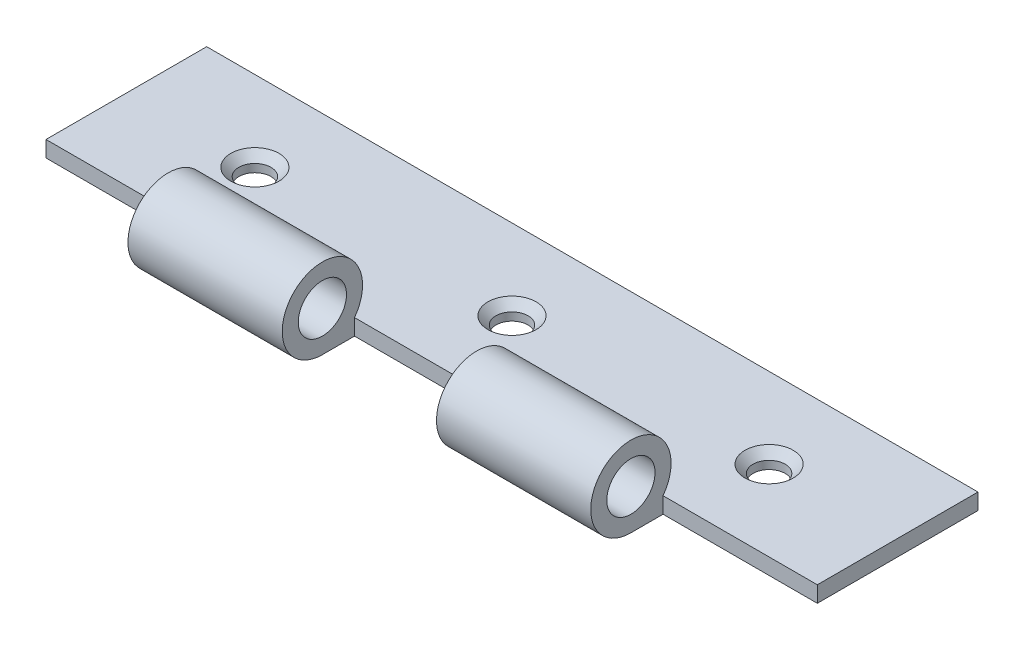
from build123d import *

# Parameters (mm, degrees)
SKETCH1_W                  = 76.2
SKETCH1_H                  = 19.05
BOSS_EXTRUDE1_DEPTH        = 1.5875
SKETCH2_R                  = 3.96875
SKETCH2_R_2                = 2.38125
BOSS_EXTRUDE2_DEPTH        = 76.2
SKETCH4_R                  = 1.5875
CUT_EXTRUDE1_DEPTH         = 41.914713601
CHAMFER1_SIZE              = 0.79375
LPATTERN1_COUNT            = 3
LPATTERN1_PITCH            = 25.4
CHAMFER1_OF_LPATTERN1_SIZE = 0.79375
CUT_EXTRUDE2_DEPTH         = 15.24
LPATTERN2_COUNT            = 5
LPATTERN2_PITCH            = 15.24


with BuildPart() as part:
    # Sketch1 → Boss-Extrude1 (new body)
    with BuildSketch(Plane(origin=(0, 0, 0), x_dir=(1, 0, 0), z_dir=(0, 1, 0))):
        Rectangle(SKETCH1_W, SKETCH1_H)
    extrude(amount=BOSS_EXTRUDE1_DEPTH)

    # Sketch2 → Boss-Extrude2 (add)
    with BuildSketch(Plane(origin=(38.1, 0, 0), x_dir=(0, 0, -1), z_dir=(1, 0, 0))):
        with Locations((-9.525, 3.96875)):
            Circle(SKETCH2_R)
        with Locations((-9.525, 3.96875)):
            Circle(SKETCH2_R_2, mode=Mode.SUBTRACT)
    extrude(amount=-BOSS_EXTRUDE2_DEPTH)

    # Sketch4 → Cut-Extrude1 (cut, through all)
    with BuildSketch(Plane(origin=(0, 1.5875, 0), x_dir=(1, 0, 0), z_dir=(0, 1, 0))):
        with Locations(Location((-25.4, 1.5875, 0), (0, 0, 270))):
            Circle(SKETCH4_R)
    cut_extrude1 = extrude(amount=-CUT_EXTRUDE1_DEPTH, mode=Mode.SUBTRACT)

    # Chamfer1
    chamfer1_edges = [part.edges().sort_by_distance(p)[0] for p in [
        (-25.4, 1.5875, -3.175),
    ]]
    chamfer(chamfer1_edges, length=CHAMFER1_SIZE)

    # LPattern1: Cut-Extrude1 ×3
    with Locations(*[(i * LPATTERN1_PITCH, 0, 0) for i in range(1, LPATTERN1_COUNT)]):
        add(cut_extrude1, mode=Mode.SUBTRACT)

    # Chamfer1 of LPattern1
    chamfer1_of_lpattern1_edges = [part.edges().sort_by_distance(p)[0] for p in [
        (0, 1.5875, -3.175),
        (25.4, 1.5875, -3.175),
    ]]
    chamfer(chamfer1_of_lpattern1_edges, length=CHAMFER1_OF_LPATTERN1_SIZE)

    # Sketch5 → Cut-Extrude2 (cut)
    with BuildSketch(Plane(origin=(38.1, 0, 0), x_dir=(0, 0, -1), z_dir=(1, 0, 0))):
        with BuildLine():
            Line((-6.35, 1.5875), (-6.35, 0))
            Line((-6.35, 0), (-9.525, 0))
            ThreePointArc((-9.525, 0), (-11.299878957, 7.518507914), (-6.35, 1.5875))
        make_face()
    cut_extrude2 = extrude(amount=-CUT_EXTRUDE2_DEPTH, mode=Mode.SUBTRACT)

    # LPattern2: Cut-Extrude2 ×5, 2 skipped
    with Locations(*[(-i * LPATTERN2_PITCH, 0, 0) for i in range(1, LPATTERN2_COUNT) if i not in (1, 3)]):
        add(cut_extrude2, mode=Mode.SUBTRACT)


solid = part.part
